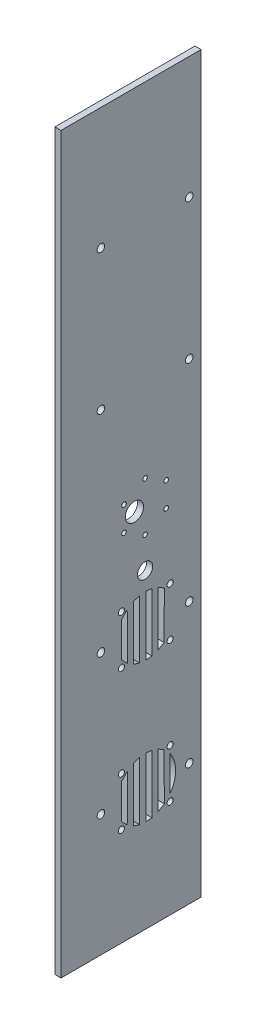
from build123d import *

# Parameters (mm, degrees)
CROQUIS3_W              = 92
CROQUIS3_H              = 482
CROQUIS3_R              = 2.5
CROQUIS3_R_2            = 2
CROQUIS3_R_3            = 5
CROQUIS3_R_4            = 1.5
CROQUIS3_R_5            = 6
SALIENTE_EXTRUIR1_DEPTH = 4


with BuildPart() as part:
    # Croquis3 → Saliente-Extruir1 (new body)
    with BuildSketch(Plane.ZY.offset(90.501614904)):
        with Locations((-42, 944.628389678)):
            Rectangle(CROQUIS3_W, CROQUIS3_H)
        with Locations((-80.223774801, 783.628389678)):
            Circle(CROQUIS3_R, mode=Mode.SUBTRACT)
        with Locations((-67.682201304, 768.118311041)):
            Circle(CROQUIS3_R_2, mode=Mode.SUBTRACT)
        with Locations((-67.682201304, 800.118311041)):
            Circle(CROQUIS3_R_2, mode=Mode.SUBTRACT)
        with Locations((-35.682201304, 800.118311041)):
            Circle(CROQUIS3_R_2, mode=Mode.SUBTRACT)
        with Locations((-35.682201304, 768.118311041)):
            Circle(CROQUIS3_R_2, mode=Mode.SUBTRACT)
        with Locations((-22.223774801, 783.628389678)):
            Circle(CROQUIS3_R, mode=Mode.SUBTRACT)
        with Locations((-67.682201304, 860.118311041)):
            Circle(CROQUIS3_R_2, mode=Mode.SUBTRACT)
        with Locations((-67.682201304, 892.118311041)):
            Circle(CROQUIS3_R_2, mode=Mode.SUBTRACT)
        with Locations((-35.682201304, 892.118311041)):
            Circle(CROQUIS3_R_2, mode=Mode.SUBTRACT)
        with Locations((-35.682201304, 860.118311041)):
            Circle(CROQUIS3_R_2, mode=Mode.SUBTRACT)
        with Locations((-22.223774801, 875.628389678)):
            Circle(CROQUIS3_R, mode=Mode.SUBTRACT)
        with Locations((-51.223774801, 907.728389678)):
            Circle(CROQUIS3_R_3, mode=Mode.SUBTRACT)
        with Locations((-51.223774801, 928.11276849)):
            Circle(CROQUIS3_R_4, mode=Mode.SUBTRACT)
        with Locations((-44.223774801, 944.628389678)):
            Circle(CROQUIS3_R_5, mode=Mode.SUBTRACT)
        with Locations((-37.360604168, 936.116673787)):
            Circle(CROQUIS3_R_4, mode=Mode.SUBTRACT)
        with Locations((-37.360604168, 952.124484381)):
            Circle(CROQUIS3_R_4, mode=Mode.SUBTRACT)
        with Locations((-51.223774801, 960.128389678)):
            Circle(CROQUIS3_R_4, mode=Mode.SUBTRACT)
        with Locations((-65.086945434, 952.124484381)):
            Circle(CROQUIS3_R_4, mode=Mode.SUBTRACT)
        with Locations((-65.086945434, 936.116673787)):
            Circle(CROQUIS3_R_4, mode=Mode.SUBTRACT)
        with Locations((-80.223774801, 1013.628389678)):
            Circle(CROQUIS3_R, mode=Mode.SUBTRACT)
        with Locations((-22.223774801, 1013.628389678)):
            Circle(CROQUIS3_R, mode=Mode.SUBTRACT)
        with Locations((-22.223774801, 1105.628389678)):
            Circle(CROQUIS3_R, mode=Mode.SUBTRACT)
        with Locations((-80.223774801, 1105.628389678)):
            Circle(CROQUIS3_R, mode=Mode.SUBTRACT)
        with Locations((-80.223774801, 875.628389678)):
            Circle(CROQUIS3_R, mode=Mode.SUBTRACT)
        with BuildLine():
            Line((-67.682201304, 795.421766265), (-67.682201304, 772.814855817))
            ThreePointArc((-67.682201304, 772.814855817), (-71.272201304, 784.118311041), (-67.682201304, 795.421766265))
        make_face(mode=Mode.SUBTRACT)
        Polygon((-59.682201304, 802.000371885), (-59.682201304, 766.236250198), (-63.865689893, 768.777818683), (-63.682201304, 799.602758077), align=None, mode=Mode.SUBTRACT)
        Polygon((-55.682201304, 803.29559187), (-55.682201304, 764.941030212), (-51.682201304, 764.528311041), (-51.682201304, 803.708311041), align=None, mode=Mode.SUBTRACT)
        Polygon((-47.682201304, 803.29559187), (-47.682201304, 764.941030212), (-43.682201304, 766.236250198), (-43.682201304, 802.000371885), align=None, mode=Mode.SUBTRACT)
        Polygon((-39.682201304, 799.602758077), (-39.498712715, 768.777818683), (-35.682201304, 772.814855817), (-35.682201304, 795.421766265), align=None, mode=Mode.SUBTRACT)
        Polygon((-35.682201304, 887.421766265), (-39.498712715, 891.4588034), (-39.682201304, 860.633864006), (-35.682201304, 864.814855817), align=None, mode=Mode.SUBTRACT)
        Polygon((-43.682201304, 894.000371885), (-47.682201304, 895.29559187), (-47.682201304, 856.941030212), (-43.682201304, 858.236250198), align=None, mode=Mode.SUBTRACT)
        Polygon((-51.682201304, 895.708311041), (-55.682201304, 895.29559187), (-55.682201304, 856.941030212), (-51.682201304, 856.528311041), align=None, mode=Mode.SUBTRACT)
        Polygon((-59.682201304, 894.000371885), (-63.865689893, 891.4588034), (-63.682201304, 860.633864006), (-59.682201304, 858.236250198), align=None, mode=Mode.SUBTRACT)
    extrude(amount=SALIENTE_EXTRUIR1_DEPTH)


solid = part.part
